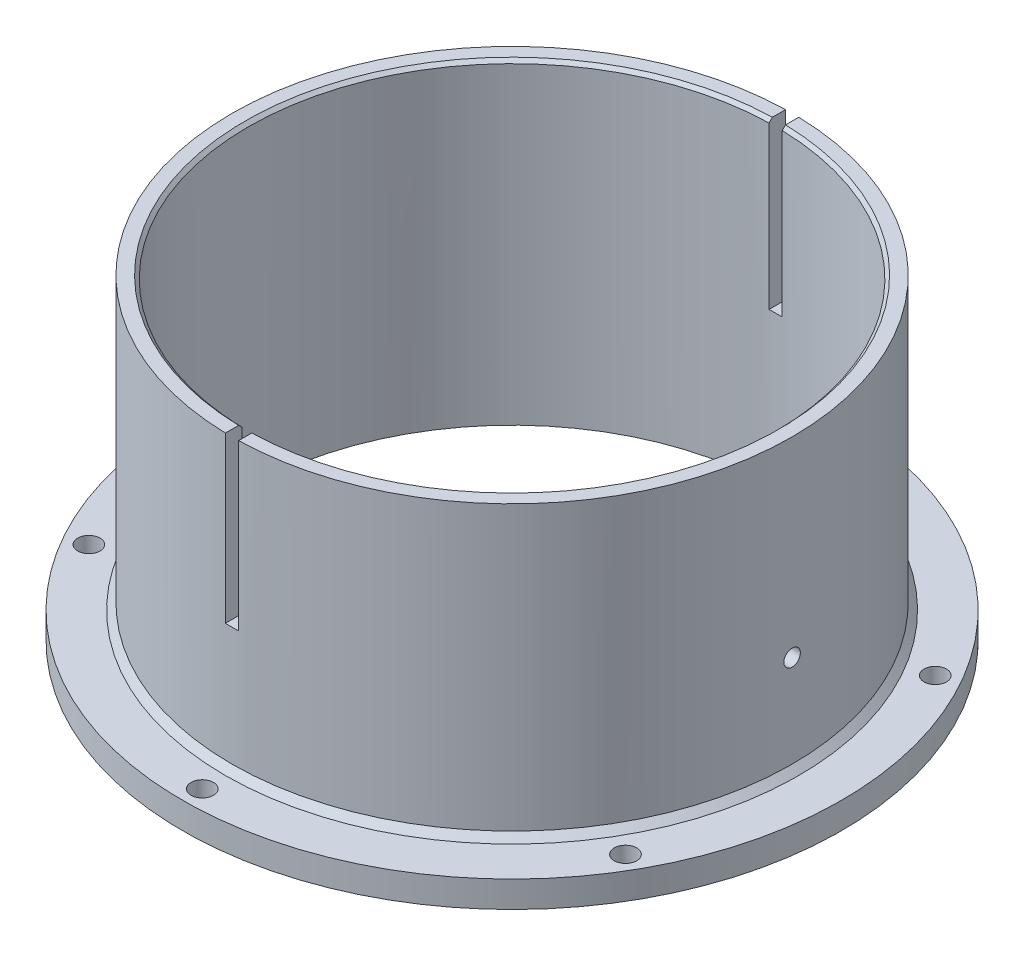
from build123d import *

# Parameters (mm, degrees)
CHAMFER_1_SIZE            = 1
CHAMFER_2_SIZE            = 0.5
SKETCH_2_W                = 2
SKETCH_2_H                = 25
CUT_EXTRUDE_695_DEPTH     = 50
HOLE_WIZARD_M3_1_D        = 3.4
HOLE_WIZARD_M3_1_2_REACH  = 111.075
HOLE_WIZARD_M3_1_2_BORE_R = 1.25


with BuildPart() as part:
    # 草图1 → 旋转1 (revolve)
    with BuildSketch(Plane.XY, mode=Mode.PRIVATE) as revolve_1_sk:
        Polygon((40, 0), (50, 0), (50, 4), (42.5, 4), (42.5, 48), (40, 48), align=None)
    revolve(revolve_1_sk.sketch.rotate(Axis((0, 0, 0), (0, 1, 0)), 90), axis=Axis((0, 0, 0), (0, 1, 0)))

    # 倒角1
    chamfer_1_edges = [part.edges().sort_by_distance(p)[0] for p in [
        (0, 4, 42.5),
    ]]
    chamfer(chamfer_1_edges, length=CHAMFER_1_SIZE)

    # 倒角2
    chamfer_2_edges = [part.edges().sort_by_distance(p)[0] for p in [
        (0, 48, 40),
    ]]
    chamfer(chamfer_2_edges, length=CHAMFER_2_SIZE)

    # 草图2 → Cut-Extrude 695 (cut, symmetric)
    with BuildSketch(Plane.XY):
        with Locations((0, 35.5)):
            Rectangle(SKETCH_2_W, SKETCH_2_H)
    extrude(amount=CUT_EXTRUDE_695_DEPTH, both=True, mode=Mode.SUBTRACT)

    # Hole Wizard M3 _1 (through all)
    with Locations(Plane(origin=(0, 0, 0), x_dir=(-1, 0, 0), z_dir=(0, -1, 0))):
        with Locations((0, 47), (40.703193978, 23.5), (40.703193978, -23.5), (0, -47), (-40.703193978, -23.5), (-40.703193978, 23.5)):
            Hole(HOLE_WIZARD_M3_1_D / 2)

    # Hole Wizard M3 _1 2 bore (on position points) → Hole Wizard M3 _1 2 (cut, up to next)
    with BuildSketch(Plane(origin=(42.5, 19, 0), x_dir=(0, 0, 1), z_dir=(1, 0, 0)), mode=Mode.PRIVATE) as hole_wizard_m3_1_2_sk1:
        Circle(HOLE_WIZARD_M3_1_2_BORE_R)
    hole_wizard_m3_1_2_tool1 = extrude(hole_wizard_m3_1_2_sk1.sketch, amount=-HOLE_WIZARD_M3_1_2_REACH, mode=Mode.PRIVATE) & part.part
    add(hole_wizard_m3_1_2_tool1.solids().sort_by_distance((42.5, 19, 0))[0], mode=Mode.SUBTRACT)


solid = part.part
